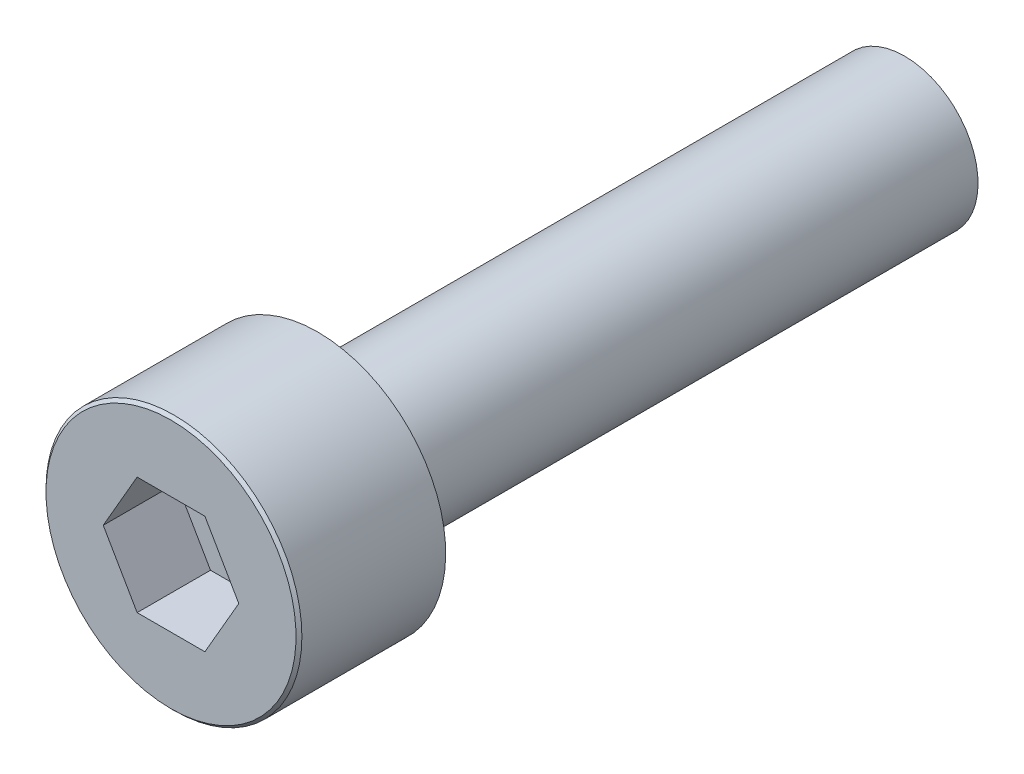
from build123d import *

# Parameters (mm, degrees)
CUT_EXTRUDE_1_DEPTH = 2.5
CHAMFER_629_SIZE    = 0.1


with BuildPart() as part:
    # 草图1 → 旋转1 (revolve)
    with BuildSketch(Plane(origin=(0, 0, 0), x_dir=(0, 0, -1), z_dir=(1, 0, 0))):
        Polygon((0, 0), (0, 4.36), (5, 4.36), (5, 2.5), (25, 2.5), (25, 0), align=None)
    revolve(axis=Axis((0, 0, -25), (0, 0, 1)))

    # 草图2 → 切除-拉伸1 (cut)
    with BuildSketch(Plane.XY):
        Polygon((1.154700538, 2), (-1.154700538, 2), (-2.309401077, 0), (-1.154700538, -2), (1.154700538, -2), (2.309401077, 0), align=None)
    extrude(amount=-CUT_EXTRUDE_1_DEPTH, mode=Mode.SUBTRACT)

    # Chamfer 629
    chamfer_629_edges = [part.edges().sort_by_distance(p)[0] for p in [
        (0, -4.36, 0),
    ]]
    chamfer(chamfer_629_edges, length=CHAMFER_629_SIZE)


solid = part.part
